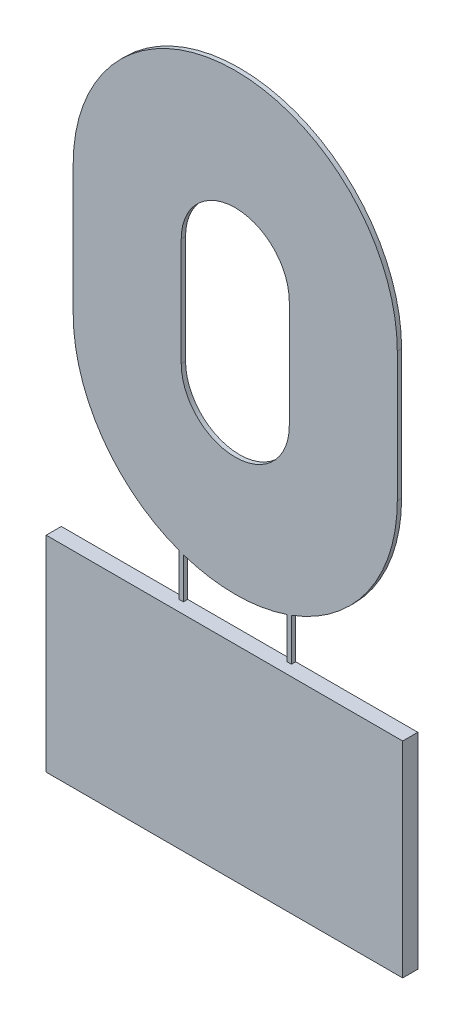
from build123d import *

# Parameters (mm, degrees)
BOSS_EXTRUDE1_DEPTH = 0.4
SKETCH2_W           = 33
SKETCH2_H           = 19
BOSS_EXTRUDE2_DEPTH = 1.4
BOSS_EXTRUDE3_START = -0.001
SKETCH3_W           = 0.4
SKETCH3_H           = 6
BOSS_EXTRUDE3_DEPTH = 0.401


with BuildPart() as part:
    # Sketch1 → Boss-Extrude1 (new body)
    with BuildSketch(Plane.XY):
        with BuildLine():
            Line((15, 6), (15, -6))
            ThreePointArc((15, -6), (0, -21), (-15, -6))
            Line((-15, -6), (-15, 6))
            ThreePointArc((-15, 6), (0, 21), (15, 6))
        make_face()
        with BuildLine():
            Line((5, 5), (5, -5))
            ThreePointArc((5, -5), (0, -10), (-5, -5))
            Line((-5, -5), (-5, 5))
            ThreePointArc((-5, 5), (0, 10), (5, 5))
        make_face(mode=Mode.SUBTRACT)
    extrude(amount=BOSS_EXTRUDE1_DEPTH)



with BuildPart() as body_2:
    # Sketch2 → Boss-Extrude2 (new body)
    with BuildSketch(Plane.XY):
        with Locations((0, -33.5)):
            Rectangle(SKETCH2_W, SKETCH2_H)
    extrude(amount=BOSS_EXTRUDE2_DEPTH)


with BuildPart() as part_1:
    add(part.part)

    add(body_2.part)  # Boss-Extrude3 merges body 2
    # Sketch3 → Boss-Extrude3 (add)
    with BuildSketch(Plane.XY.offset(BOSS_EXTRUDE3_START)):
        with Locations((5, -21.260407867)):
            Rectangle(SKETCH3_W, SKETCH3_H)
        with Locations((-5, -21.22123599)):
            Rectangle(SKETCH3_W, SKETCH3_H)
    extrude(amount=BOSS_EXTRUDE3_DEPTH)


solid = part_1.part
